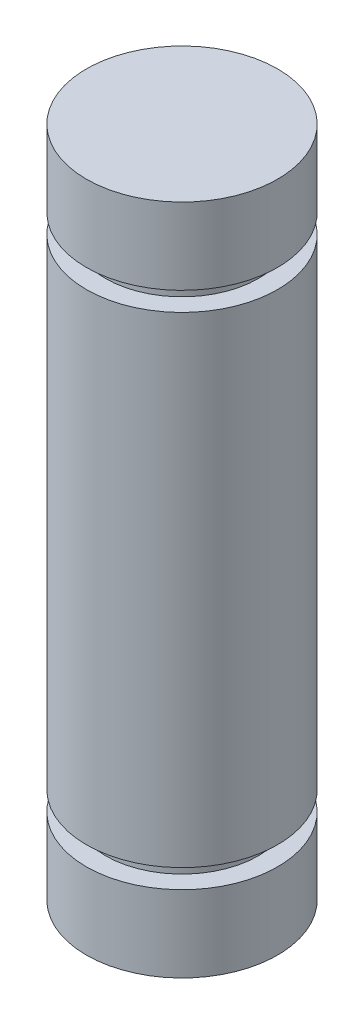
from build123d import *

# Parameters (mm, degrees)
SKETCH1_R           = 6.35
BOSS_EXTRUDE2_DEPTH = 31.9405
SKETCH4_R           = 5.08
BOSS_EXTRUDE3_DEPTH = 1.27
SKETCH5_R           = 6.35
BOSS_EXTRUDE4_DEPTH = 5.08
BOSS_EXTRUDE5_START = 1.27
SKETCH6_R           = 5.08
BOSS_EXTRUDE5_DEPTH = 1.27
BOSS_EXTRUDE6_START = 5.08
SKETCH7_R           = 6.35
BOSS_EXTRUDE6_DEPTH = 5.08


with BuildPart() as part:
    # Sketch1 → Boss-Extrude2 (new body)
    with BuildSketch(Plane(origin=(0, 0, 0), x_dir=(1, 0, 0), z_dir=(0, 1, 0))):
        with Locations(Location((0, 0, 0), (0, 0, 270))):
            Circle(SKETCH1_R)
    extrude(amount=BOSS_EXTRUDE2_DEPTH)

    # Sketch4 → Boss-Extrude3 (add)
    with BuildSketch(Plane(origin=(0, 31.9405, 0), x_dir=(1, 0, 0), z_dir=(0, 1, 0))):
        with Locations(Location((0, 0, 0), (0, 0, 270))):
            Circle(SKETCH4_R)
    extrude(amount=BOSS_EXTRUDE3_DEPTH)

    # Sketch5 → Boss-Extrude4 (add)
    with BuildSketch(Plane(origin=(0, 33.2105, 0), x_dir=(1, 0, 0), z_dir=(0, 1, 0))):
        with Locations(Location((0, 0, 0), (0, 0, 270))):
            Circle(SKETCH5_R)
    extrude(amount=BOSS_EXTRUDE4_DEPTH)

    # Sketch6 → Boss-Extrude5 (add)
    with BuildSketch(Plane.XZ.offset(BOSS_EXTRUDE5_START)):
        with Locations(Location((0, 0, 0), (0, 0, 90))):
            Circle(SKETCH6_R)
    extrude(amount=-BOSS_EXTRUDE5_DEPTH)

    # Sketch7 → Boss-Extrude6 (add)
    with BuildSketch(Plane.XZ.offset(1.27).offset(BOSS_EXTRUDE6_START)):
        with Locations(Location((0, 0, 0), (0, 0, 90))):
            Circle(SKETCH7_R)
    extrude(amount=-BOSS_EXTRUDE6_DEPTH)


solid = part.part
